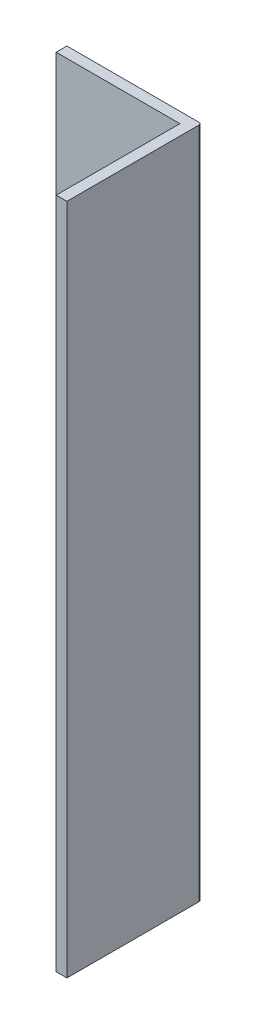
from build123d import *

# Parameters (mm, degrees)
SALIENTE_EXTRUIR1_DEPTH = 125


with BuildPart() as part:
    # Croquis1 → Saliente-Extruir1 (new body)
    with BuildSketch(Plane(origin=(0, 0, 0), x_dir=(1, 0, 0), z_dir=(0, 1, 0))):
        with BuildLine():
            Line((-23, 23), (0, 23))
            Line((0, 23), (0, 0))
            Line((0, 0), (2, 0))
            Line((2, 0), (2, 24.5))
            ThreePointArc((2, 24.5), (1.853553391, 24.853553391), (1.5, 25))
            Line((1.5, 25), (-23, 25))
            Line((-23, 25), (-23, 23))
        make_face()
    extrude(amount=SALIENTE_EXTRUIR1_DEPTH)


solid = part.part
